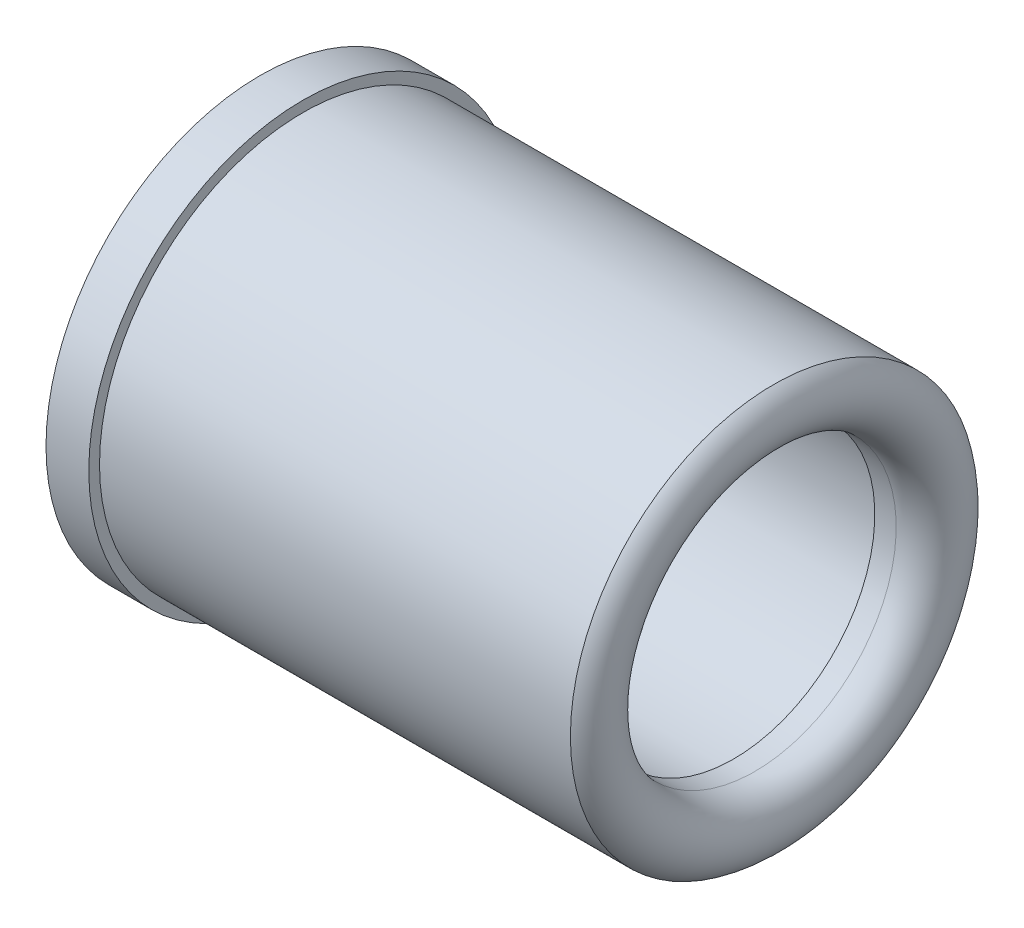
from build123d import *


with BuildPart() as part:
    # Sketch1 → Revolve1 (revolve)
    with BuildSketch(Plane(origin=(0, 0, 0), x_dir=(-1, 0, 0), z_dir=(0, 0, -1)), mode=Mode.PRIVATE) as revolve1_sk:
        with BuildLine():
            Line((-11.972812665, -5.233263235), (-11.972812665, -4.983263235))
            Line((-11.972812665, -4.983263235), (-0.912123334, -4.983263235))
            Line((-0.912123334, -4.983263235), (-0.912123334, -3.533263235))
            Line((-0.912123334, -3.533263235), (-1.912123334, -3.533263235))
            Line((-1.912123334, -3.533263235), (-1.912123334, -3.783263235))
            Line((-1.912123334, -3.783263235), (-12.912123334, -3.783263235))
            ThreePointArc((-12.912123334, -3.783263235), (-13.230357031, -4.671229021), (-12.472812665, -5.233263235))
            Line((-12.472812665, -5.233263235), (-11.972812665, -5.233263235))
        make_face()
    revolve(revolve1_sk.sketch.rotate(Axis((12.175741694, -8.533263235, 0), (-1, 0, 0)), 270), axis=Axis((12.175741694, -8.533263235, 0), (-1, 0, 0)))


solid = part.part
